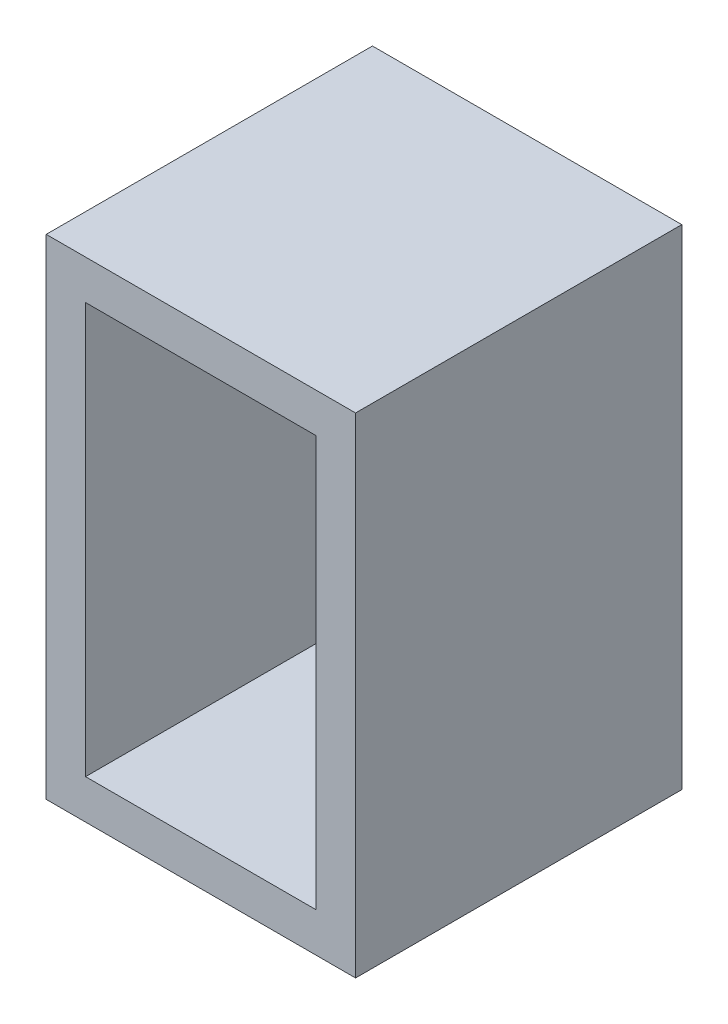
from build123d import *

# Parameters (mm, degrees)
SKETCH1_W           = 24.5
SKETCH1_H           = 40.5
SKETCH1_W_2         = 20.5
SKETCH1_H_2         = 36.5
BOSS_EXTRUDE1_DEPTH = 27
SKETCH1_2_W         = 24.5
SKETCH1_2_H         = 40.5
SKETCH1_2_W_2       = 20.5
SKETCH1_2_H_2       = 36.5
BOSS_EXTRUDE2_DEPTH = 2
SKETCH2_W           = 9
SKETCH2_H           = 22
CUT_EXTRUDE1_DEPTH  = 2
CUT_EXTRUDE2_DEPTH  = 2
SKETCH4_W           = 27.5
SKETCH4_H           = 43.5
SKETCH4_W_2         = 24.5
SKETCH4_H_2         = 40.5
BOSS_EXTRUDE3_DEPTH = 29
SKETCH5_W           = 9
SKETCH5_H           = 1.5
CUT_EXTRUDE3_DEPTH  = 2


with BuildPart() as part:
    # Sketch1 → Boss-Extrude1 (new body)
    with BuildSketch(Plane.XY):
        Rectangle(SKETCH1_W, SKETCH1_H)
        Rectangle(SKETCH1_W_2, SKETCH1_H_2, mode=Mode.SUBTRACT)
    extrude(amount=BOSS_EXTRUDE1_DEPTH)

    # Sketch1<2> → Boss-Extrude2 (add)
    # profile 1 of 2: a face of its own
    with BuildSketch(Plane.XY):
        Rectangle(SKETCH1_2_W, SKETCH1_2_H)
        Rectangle(SKETCH1_2_W_2, SKETCH1_2_H_2, mode=Mode.SUBTRACT)
    # profile 2 of 2: a face of its own
    with BuildSketch(Plane.XY):
        Rectangle(SKETCH1_2_W_2, SKETCH1_2_H_2)
    extrude(amount=-BOSS_EXTRUDE2_DEPTH)

    # Sketch2 → Cut-Extrude1 (cut)
    with BuildSketch(Plane(origin=(0, 0, -2), x_dir=(-1, 0, 0), z_dir=(0, 0, -1))):
        with Locations((-5.75, -4.25)):
            Rectangle(SKETCH2_W, SKETCH2_H)
    extrude(amount=-CUT_EXTRUDE1_DEPTH, mode=Mode.SUBTRACT)

    # Sketch3 → Cut-Extrude2 (cut)
    with BuildSketch(Plane(origin=(0, 0, -2), x_dir=(-1, 0, 0), z_dir=(0, 0, -1))):
        Polygon((-11.75, 9.45), (-11.75, 8.25), (0.25, 8.25), (1.45, 8.25), (1.45, 9.45), align=None)
    extrude(amount=-CUT_EXTRUDE2_DEPTH, mode=Mode.SUBTRACT)

    # Sketch4 → Boss-Extrude3 (add)
    with BuildSketch(Plane(origin=(0, 0, -2), x_dir=(-1, 0, 0), z_dir=(0, 0, -1))):
        Rectangle(SKETCH4_W, SKETCH4_H)
        Rectangle(SKETCH4_W_2, SKETCH4_H_2, mode=Mode.SUBTRACT)
    extrude(amount=-BOSS_EXTRUDE3_DEPTH)

    # Sketch5 → Cut-Extrude3 (cut)
    with BuildSketch(Plane.XY):
        with Locations((5.75, 7.5)):
            Rectangle(SKETCH5_W, SKETCH5_H)
    extrude(amount=-CUT_EXTRUDE3_DEPTH, mode=Mode.SUBTRACT)


solid = part.part
